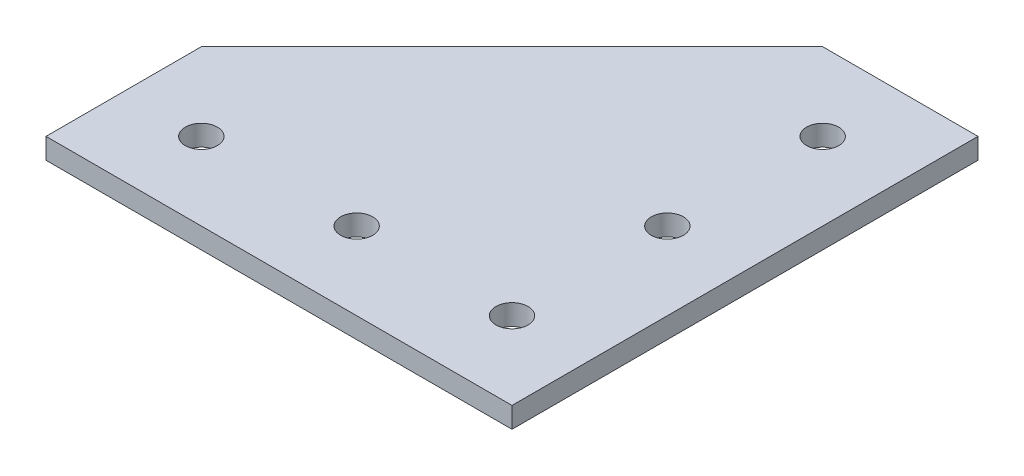
from build123d import *

# Parameters (mm, degrees)
SKETCH1_R           = 3.1
BOSS_EXTRUDE1_DEPTH = 4


with BuildPart() as part:
    # Sketch1 → Boss-Extrude1 (new body)
    with BuildSketch(Plane(origin=(0, 0, 0), x_dir=(1, 0, 0), z_dir=(0, 1, 0))):
        Polygon((0, 0), (0, -90), (-90, -90), (-90, -60), (-30, 0), align=None)
        with Locations(Location((-15, -15, 0), (0, 0, 270))):
            Circle(SKETCH1_R, mode=Mode.SUBTRACT)
        with Locations(Location((-15, -45, 0), (0, 0, 270))):
            Circle(SKETCH1_R, mode=Mode.SUBTRACT)
        with Locations(Location((-15, -75, 0), (0, 0, 270))):
            Circle(SKETCH1_R, mode=Mode.SUBTRACT)
        with Locations(Location((-45, -75, 0), (0, 0, 270))):
            Circle(SKETCH1_R, mode=Mode.SUBTRACT)
        with Locations(Location((-75, -75, 0), (0, 0, 270))):
            Circle(SKETCH1_R, mode=Mode.SUBTRACT)
    extrude(amount=BOSS_EXTRUDE1_DEPTH)


solid = part.part
